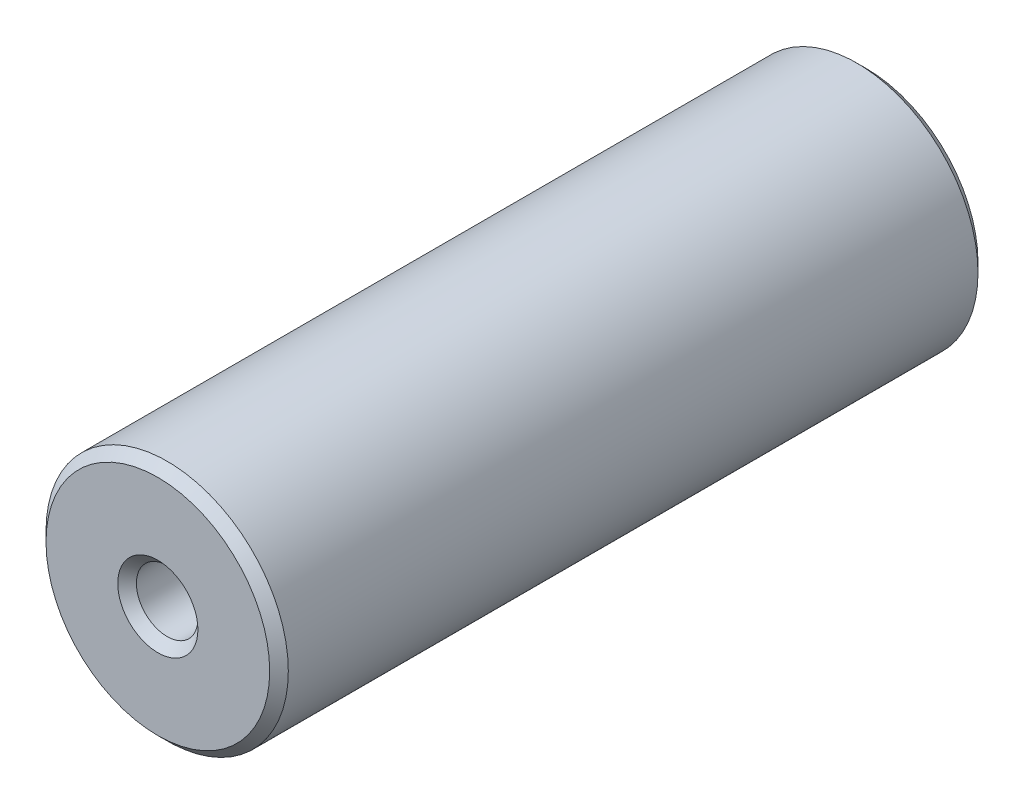
from build123d import *

# Parameters (mm, degrees)
ESQUISSE1_R        = 13
ESQUISSE1_R_2      = 3.3
BOSS_EXTRU_1_DEPTH = 76
CHANFREIN1_SIZE    = 1


with BuildPart() as part:
    # Esquisse1 → Boss.-Extru.1 (new body)
    with BuildSketch(Plane.XY):
        Circle(ESQUISSE1_R)
        Circle(ESQUISSE1_R_2, mode=Mode.SUBTRACT)
    extrude(amount=BOSS_EXTRU_1_DEPTH)

    # Chanfrein1
    chanfrein1_edges = [part.edges().sort_by_distance(p)[0] for p in [
        (-13, 0, 0),
        (-13, 0, 76),
        (-3.3, 0, 0),
        (-3.3, 0, 76),
    ]]
    chamfer(chanfrein1_edges, length=CHANFREIN1_SIZE)


solid = part.part
